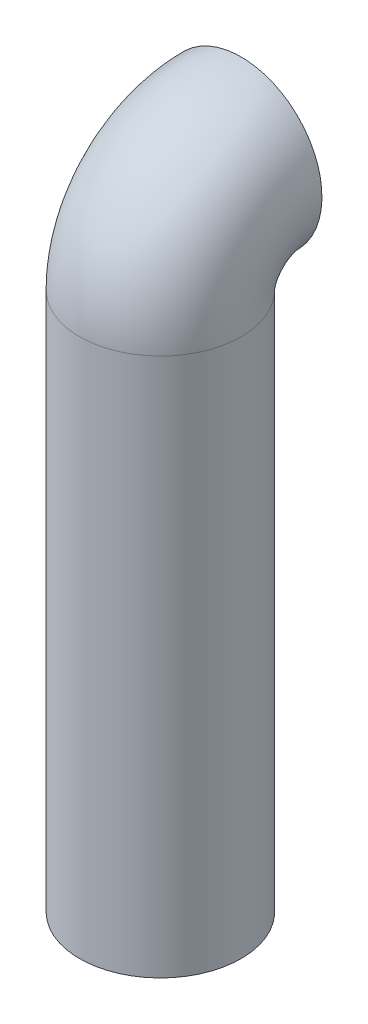
from build123d import *

# Parameters (mm, degrees)
SKETCH2_R           = 45
SKETCH3_R           = 10
CUT_EXTRUDE1_DEPTH  = 20
SKETCH4_R           = 45
BOSS_EXTRUDE1_DEPTH = 300
SKETCH5_R           = 10
CUT_EXTRUDE2_DEPTH  = 20


with BuildPart() as part:
    # Sweep1: sweep along a path in Sketch1
    with BuildLine(Plane(origin=(0, 0, 0), x_dir=(0, 0, -1), z_dir=(1, 0, 0))) as sweep1_path:
        ThreePointArc((0, 45), (-31.819805153, 31.819805153), (-45, 0))
    # Sketch2 → Sweep1 (sweep)
    with BuildSketch(Plane(origin=(0, 0, 0), x_dir=(1, 0, 0), z_dir=(0, 1, 0))):
        with Locations((0, -45)):
            Circle(SKETCH2_R)
    sweep(path=sweep1_path.line)

    # Sketch3 → Cut-Extrude1 (cut)
    with BuildSketch(Plane(origin=(0, 0, 0), x_dir=(-1, 0, 0), z_dir=(0, 0, -1))):
        with Locations(Location((0, 45, 0), (0, 0, 90))):
            Circle(SKETCH3_R)
    extrude(amount=-CUT_EXTRUDE1_DEPTH, mode=Mode.SUBTRACT)

    # Sketch4 → Boss-Extrude1 (add)
    with BuildSketch(Plane.XZ):
        with Locations(Location((0, 45, 0), (0, 0, 270))):
            Circle(SKETCH4_R)
    extrude(amount=BOSS_EXTRUDE1_DEPTH)

    # Sketch5 → Cut-Extrude2 (cut)
    with BuildSketch(Plane.XZ.offset(300)):
        with Locations(Location((0, 45, 0), (0, 0, 270))):
            Circle(SKETCH5_R)
    extrude(amount=-CUT_EXTRUDE2_DEPTH, mode=Mode.SUBTRACT)


solid = part.part
